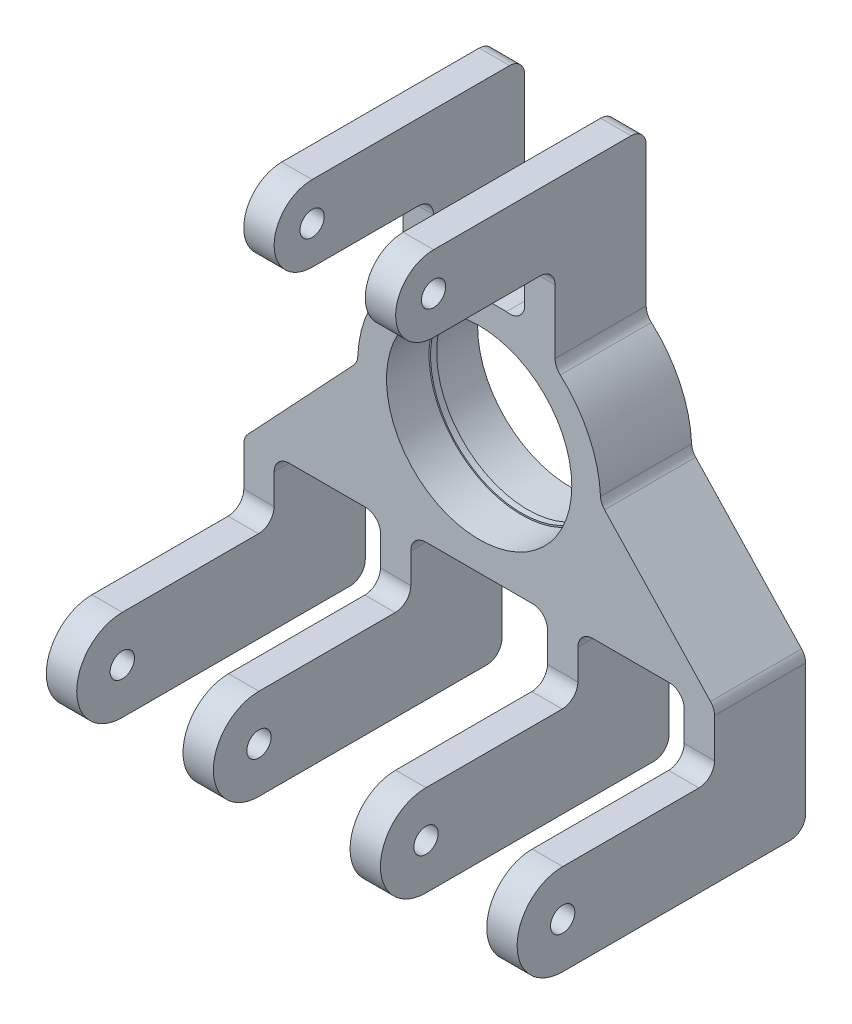
from build123d import *

# Parameters (mm, degrees)
BOSS_EXTRUDE2_DEPTH     = 30
SKETCH2_R               = 4
BOSS_EXTRUDE3_DEPTH     = 10
CUT_EXTRUDE3_DEPTH      = 162
SKETCH4_R               = 4
BOSS_EXTRUDE4_DEPTH     = 10
SKETCH5_R               = 4
BOSS_EXTRUDE5_DEPTH     = 10
SKETCH6_R               = 4
BOSS_EXTRUDE6_DEPTH     = 10
SKETCH7_R               = 4
BOSS_EXTRUDE7_DEPTH     = 10
CUT_EXTRUDE4_DEPTH      = 167.226502099
CUT_EXTRUDE4_DEPTH_BACK = 57
SKETCH13_R              = 4
BOSS_EXTRUDE8_DEPTH     = 10
SKETCH14_R              = 30
CUT_EXTRUDE5_DEPTH      = 136.392946641
SKETCH15_R              = 30.5
CUT_EXTRUDE6_DEPTH      = 14
CUT_EXTRUDE7_START      = -14
SKETCH16_R              = 30.5
CUT_EXTRUDE7_DEPTH      = 14


with BuildPart() as part:
    # Sketch1 → Boss-Extrude2 (new body)
    with BuildSketch(Plane.XY):
        with BuildLine():
            Line((-15, 84.641016151), (-15, 43.789443996))
            ThreePointArc((-15, 43.789443996), (-13.139996453, 39.931036758), (-8.962922752, 38.982893886))
            Line((-8.962922752, 38.982893886), (8.962922752, 38.982893886))
            ThreePointArc((8.962922752, 38.982893886), (13.139996453, 39.931036758), (15, 43.789443996))
            Line((15, 43.789443996), (15, 84.641016151))
            Line((15, 84.641016151), (25, 84.641016151))
            Line((25, 84.641016151), (25, 33.611468644))
            ThreePointArc((25, 33.611468644), (25.447741208, 31.509528534), (26.713227694, 29.772528717))
            ThreePointArc((26.713227694, 29.772528717), (36.156075964, 17.109592948), (39.96044462, 1.778444757))
            ThreePointArc((39.96044462, 1.778444757), (40.342615834, 0.082521187), (41.289478696, -1.375443942))
            Line((41.289478696, -1.375443942), (76.166088788, -38.577161373))
            ThreePointArc((76.166088788, -38.577161373), (77.154414497, -40.136660916), (77.5, -41.950330454))
            Line((77.5, -41.950330454), (77.5, -90))
            Line((77.5, -90), (67.5, -90))
            Line((67.5, -90), (67.5, -44.931958231))
            ThreePointArc((67.5, -44.931958231), (66.055462879, -41.444537121), (62.568041769, -40))
            Line((62.568041769, -40), (37.431958231, -40))
            ThreePointArc((37.431958231, -40), (33.944537121, -41.444537121), (32.5, -44.931958231))
            Line((32.5, -44.931958231), (32.5, -90))
            Line((32.5, -90), (22.5, -90))
            Line((22.5, -90), (22.5, -44.931958231))
            ThreePointArc((22.5, -44.931958231), (21.055462879, -41.444537121), (17.568041769, -40))
            Line((17.568041769, -40), (-17.568041769, -40))
            ThreePointArc((-17.568041769, -40), (-21.055462879, -41.444537121), (-22.5, -44.931958231))
            Line((-22.5, -44.931958231), (-22.5, -90))
            Line((-22.5, -90), (-32.5, -90))
            Line((-32.5, -90), (-32.5, -44.931958231))
            ThreePointArc((-32.5, -44.931958231), (-33.944537121, -41.444537121), (-37.431958231, -40))
            Line((-37.431958231, -40), (-62.568041769, -40))
            ThreePointArc((-62.568041769, -40), (-66.055462879, -41.444537121), (-67.5, -44.931958231))
            Line((-67.5, -44.931958231), (-67.5, -90))
            Line((-67.5, -90), (-77.5, -90))
            Line((-77.5, -90), (-77.5, -41.950330454))
            ThreePointArc((-77.5, -41.950330454), (-77.154414497, -40.136660916), (-76.166088788, -38.577161373))
            Line((-76.166088788, -38.577161373), (-41.289478696, -1.375443942))
            ThreePointArc((-41.289478696, -1.375443942), (-40.342615834, 0.082521187), (-39.96044462, 1.778444757))
            ThreePointArc((-39.96044462, 1.778444757), (-36.156075964, 17.109592948), (-26.713227694, 29.772528717))
            ThreePointArc((-26.713227694, 29.772528717), (-25.447741208, 31.509528534), (-25, 33.611468644))
            Line((-25, 33.611468644), (-25, 84.641016151))
            Line((-25, 84.641016151), (-15, 84.641016151))
        make_face()
    extrude(amount=BOSS_EXTRUDE2_DEPTH)

    # Sketch2 → Boss-Extrude3 (add)
    with BuildSketch(Plane.ZY.offset(77.5)):
        with BuildLine():
            Line((30, -54.842305853), (30, -90))
            Line((30, -90), (80, -90))
            ThreePointArc((80, -90), (95, -75), (80, -60))
            Line((80, -60), (35.157694147, -60))
            ThreePointArc((35.157694147, -60), (31.51065364, -58.48934636), (30, -54.842305853))
        make_face()
        with Locations((80, -75)):
            Circle(SKETCH2_R, mode=Mode.SUBTRACT)
    extrude(amount=-BOSS_EXTRUDE3_DEPTH)

    # Sketch3 → Cut-Extrude3 (cut)
    with BuildSketch(Plane.ZY.offset(77.5)):
        with BuildLine():
            ThreePointArc((5, -90), (1.464466094, -88.535533906), (0, -85))
            Line((0, -85), (0, -90))
            Line((0, -90), (5, -90))
        make_face()
    extrude(amount=-CUT_EXTRUDE3_DEPTH, mode=Mode.SUBTRACT)

    # Sketch4 → Boss-Extrude4 (add)
    with BuildSketch(Plane.ZY.offset(32.5)):
        with BuildLine():
            Line((30, -54.842305853), (30, -90))
            Line((30, -90), (80, -90))
            ThreePointArc((80, -90), (95, -75), (80, -60))
            Line((80, -60), (35.157694147, -60))
            ThreePointArc((35.157694147, -60), (31.51065364, -58.48934636), (30, -54.842305853))
        make_face()
        with Locations((80, -75)):
            Circle(SKETCH4_R, mode=Mode.SUBTRACT)
    extrude(amount=-BOSS_EXTRUDE4_DEPTH)

    # Sketch5 → Boss-Extrude5 (add)
    with BuildSketch(Plane.ZY.offset(-22.5)):
        with BuildLine():
            Line((30, -54.842305853), (30, -90))
            Line((30, -90), (80, -90))
            ThreePointArc((80, -90), (95, -75), (80, -60))
            Line((80, -60), (35.157694147, -60))
            ThreePointArc((35.157694147, -60), (31.51065364, -58.48934636), (30, -54.842305853))
        make_face()
        with Locations((80, -75)):
            Circle(SKETCH5_R, mode=Mode.SUBTRACT)
    extrude(amount=-BOSS_EXTRUDE5_DEPTH)

    # Sketch6 → Boss-Extrude6 (add)
    with BuildSketch(Plane.ZY.offset(-67.5)):
        with BuildLine():
            Line((30, -54.842305853), (30, -90))
            Line((30, -90), (80, -90))
            ThreePointArc((80, -90), (95, -75), (80, -60))
            Line((80, -60), (35.157694147, -60))
            ThreePointArc((35.157694147, -60), (31.51065364, -58.48934636), (30, -54.842305853))
        make_face()
        with Locations((80, -75)):
            Circle(SKETCH6_R, mode=Mode.SUBTRACT)
    extrude(amount=-BOSS_EXTRUDE6_DEPTH)

    # Sketch7 → Boss-Extrude7 (add)
    with BuildSketch(Plane.ZY.offset(25)):
        with BuildLine():
            Line((70, 84.641016151), (30, 84.641016151))
            Line((30, 84.641016151), (30, 54.641016151))
            ThreePointArc((30, 54.641016151), (31.464466094, 58.176550057), (35, 59.641016151))
            Line((35, 59.641016151), (70, 59.641016151))
            ThreePointArc((70, 59.641016151), (82.5, 72.141016151), (70, 84.641016151))
        make_face()
        with Locations((70, 72.141016151)):
            Circle(SKETCH7_R, mode=Mode.SUBTRACT)
    extrude(amount=-BOSS_EXTRUDE7_DEPTH)

    # Sketch9 → Cut-Extrude4 (cut, two sides: drawn at the far end of the back side and taken through both)
    with BuildSketch(Plane.ZY.offset(25).offset(-CUT_EXTRUDE4_DEPTH_BACK)):
        with BuildLine():
            Line((0, 84.641016151), (0, 79.641016151))
            ThreePointArc((0, 79.641016151), (1.464466094, 83.176550057), (5, 84.641016151))
            Line((5, 84.641016151), (0, 84.641016151))
        make_face()
    extrude(amount=CUT_EXTRUDE4_DEPTH + CUT_EXTRUDE4_DEPTH_BACK, mode=Mode.SUBTRACT)

    # Sketch13 → Boss-Extrude8 (add)
    with BuildSketch(Plane.ZY.offset(-15)):
        with BuildLine():
            Line((70, 84.641016151), (30, 84.641016151))
            Line((30, 84.641016151), (30, 54.641016151))
            ThreePointArc((30, 54.641016151), (31.464466094, 58.176550057), (35, 59.641016151))
            Line((35, 59.641016151), (70, 59.641016151))
            ThreePointArc((70, 59.641016151), (82.5, 72.141016151), (70, 84.641016151))
        make_face()
        with Locations((70, 72.141016151)):
            Circle(SKETCH13_R, mode=Mode.SUBTRACT)
    extrude(amount=-BOSS_EXTRUDE8_DEPTH)

    # Sketch14 → Cut-Extrude5 (cut, through all)
    with BuildSketch(Plane.XY.offset(30)):
        Circle(SKETCH14_R)
    extrude(amount=-CUT_EXTRUDE5_DEPTH, mode=Mode.SUBTRACT)

    # Sketch15 → Cut-Extrude6 (cut)
    with BuildSketch(Plane.XY.offset(30)):
        Circle(SKETCH15_R)
    extrude(amount=-CUT_EXTRUDE6_DEPTH, mode=Mode.SUBTRACT)

    # Sketch16 → Cut-Extrude7 (cut)
    with BuildSketch(Plane(origin=(0, 0, 0), x_dir=(-1, 0, 0), z_dir=(0, 0, -1)).offset(CUT_EXTRUDE7_START)):
        with Locations(Location((0, 0, 0), (0, 0, 180))):
            Circle(SKETCH16_R)
    extrude(amount=CUT_EXTRUDE7_DEPTH, mode=Mode.SUBTRACT)


solid = part.part
